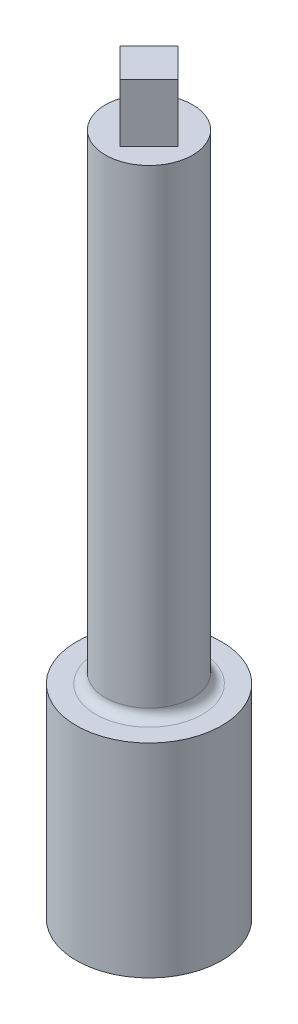
from build123d import *

# Parameters (mm, degrees)
EXTRUDE1_DEPTH = 12


with BuildPart() as part:
    # Sketch1 → Revolve1 (revolve)
    with BuildSketch(Plane.XY, mode=Mode.PRIVATE) as revolve1_sk:
        with BuildLine():
            Line((0, 95.711947491), (-9, 95.711947491))
            Line((-9, 95.711947491), (-9, -1.288052509))
            ThreePointArc((-9, -1.288052509), (-9.585786438, -2.702266071), (-11, -3.288052509))
            Line((-11, -3.288052509), (-15, -3.288052509))
            Line((-15, -3.288052509), (-15, -45.288052509))
            Line((-15, -45.288052509), (-6, -45.288052509))
            Line((-6, -45.288052509), (-6, -13.288052509))
            Line((-6, -13.288052509), (0, -13.288052509))
            Line((0, -13.288052509), (0, 95.711947491))
        make_face()
    revolve(revolve1_sk.sketch.rotate(Axis((0, 0, 0), (0, 1, 0)), 270), axis=Axis((0, 0, 0), (0, 1, 0)))

    # Sketch2 → Extrude1 (add)
    with BuildSketch(Plane(origin=(0, 95.711947491, 0), x_dir=(-1, 0, 0), z_dir=(0, 1, 0))):
        Polygon((-6, 0), (0, -6), (6, 0), (0, 6), align=None)
    extrude(amount=EXTRUDE1_DEPTH)


solid = part.part
